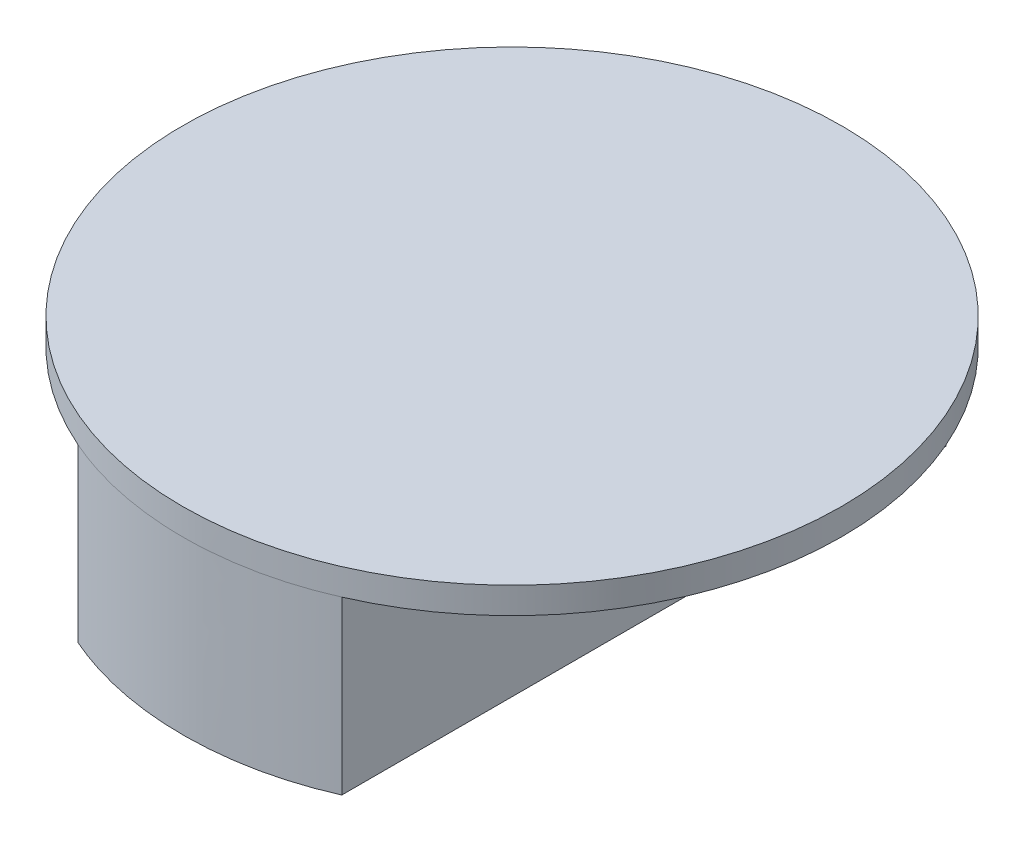
from build123d import *

# Parameters (mm, degrees)
SKETCH5_R           = 6.35
BOSS_EXTRUDE4_DEPTH = 0.508
BOSS_EXTRUDE8_DEPTH = 3.302


with BuildPart() as part:
    # Sketch5 → Boss-Extrude4 (new body)
    with BuildSketch(Plane(origin=(0, 0, 0), x_dir=(1, 0, 0), z_dir=(0, 1, 0))):
        with Locations(Location((0, 0, 0), (0, 0, 270))):
            Circle(SKETCH5_R)
    extrude(amount=BOSS_EXTRUDE4_DEPTH)

    # Sketch7 → Boss-Extrude8 (add)
    with BuildSketch(Plane.XZ):
        with BuildLine():
            Line((2.54, -5.819871133), (2.54, 5.819871133))
            add(Edge.make_bspline(
                [(2.54, 5.819871133), (0.946994971, 6.530692712), (-0.951796694, 6.519444039), (-2.54, 5.819871133)],
                knots=[0, 0, 0, 0, 1, 1, 1, 1], degree=3))
            Line((-2.54, 5.819871133), (-2.54, -5.819871133))
            add(Edge.make_bspline(
                [(2.54, -5.819871133), (0.946994971, -6.530692712), (-0.951796694, -6.519444039), (-2.54, -5.819871133)],
                knots=[0, 0, 0, 0, 1, 1, 1, 1], degree=3))
        make_face()
    extrude(amount=BOSS_EXTRUDE8_DEPTH)


solid = part.part
